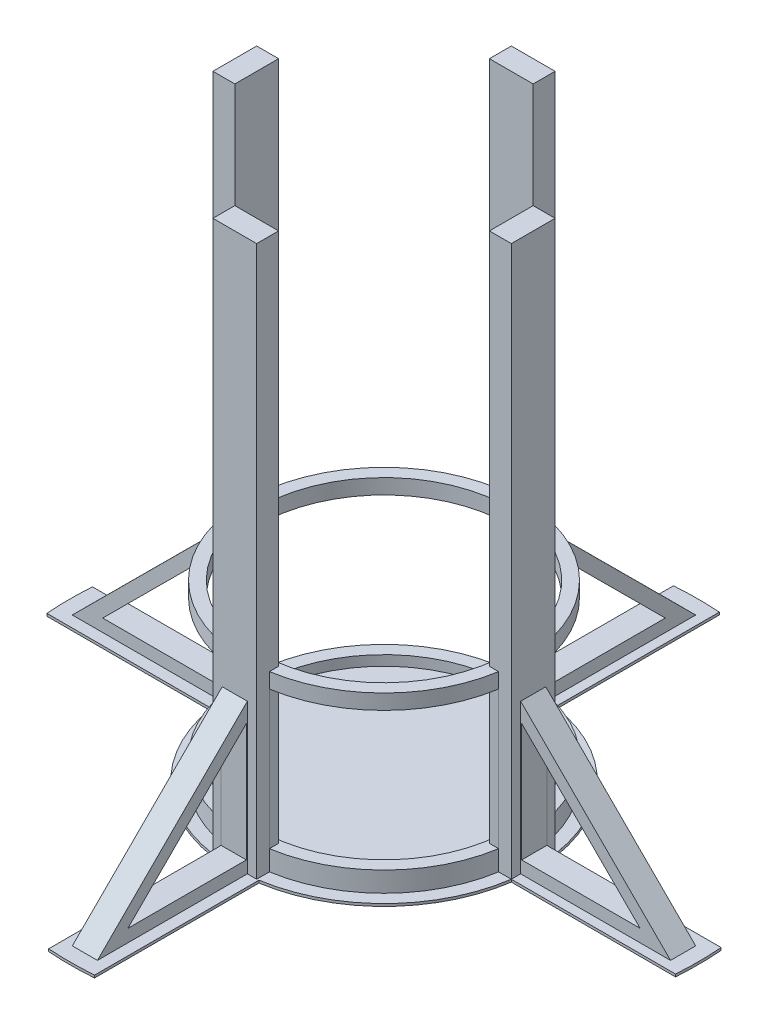
from build123d import *

# Parameters (mm, degrees)
SKETCH2_R           = 55
BOSS_EXTRUDE1_DEPTH = 70
SHELL1_T            = -5
SKETCH4_R           = 125
BOSS_EXTRUDE2_DEPTH = 1
RIB7_REACH          = 192.132
SKETCH3_WALL_W      = 472.644862012
SKETCH3_WALL_H      = 10
CIRPATTERN1_COUNT   = 4
CUT_EXTRUDE1_DEPTH  = 1
CIRPATTERN2_COUNT   = 4
CUT_EXTRUDE2_DEPTH  = 194.455421222
CIRPATTERN3_COUNT   = 4
SKETCH10_W          = 64.387061578
SKETCH10_H          = 55
CUT_EXTRUDE3_DEPTH  = 191.131533418
CIRPATTERN4_COUNT   = 2
CIRPATTERN4_ANGLE   = 90
BOSS_EXTRUDE3_START = -70
SKETCH11_W          = 8.729109108
SKETCH11_H          = 17.418342354
BOSS_EXTRUDE3_DEPTH = 220
CIRPATTERN5_COUNT   = 4


with BuildPart() as part:
    # Sketch2 → Boss-Extrude1 (new body)
    with BuildSketch(Plane(origin=(0, 0, 0), x_dir=(1, 0, 0), z_dir=(0, 1, 0))):
        with Locations(Location((0, 0, 0), (0, 0, 270))):
            Circle(SKETCH2_R)
    extrude(amount=BOSS_EXTRUDE1_DEPTH)

    # Shell1
    shell1_openings = [part.faces().sort_by_distance(p)[0] for p in [
        (0, 70, 0),
    ]]
    offset(amount=SHELL1_T, openings=shell1_openings, kind=Kind.INTERSECTION)

    # Sketch4 → Boss-Extrude2 (add)
    with BuildSketch(Plane(origin=(0, 0, 0), x_dir=(1, 0, 0), z_dir=(0, 1, 0))):
        with Locations(Location((0, 0, 0), (0, 0, 270))):
            Circle(SKETCH4_R)
    extrude(amount=BOSS_EXTRUDE2_DEPTH)

    # Sketch3 wall → Rib7 (add, up to next)
    with BuildSketch(Plane(origin=(87, 32.90951621, 0), x_dir=(0.708107200971, -0.706104943994, 0), z_dir=(0.706104943994, 0.708107200971, 0)), mode=Mode.PRIVATE) as rib7_sk1:
        Rectangle(SKETCH3_WALL_W, SKETCH3_WALL_H)
    rib7_tool1 = extrude(rib7_sk1.sketch, amount=-RIB7_REACH, mode=Mode.PRIVATE) - part.part
    rib7 = rib7_tool1.solids().sort_by_distance((87, 32.90951621, 0))[0]
    add(rib7)

    # CirPattern1: Rib7 ×4 about axis
    cirpattern1_axis = Axis((0, 0, 0), (0, 1, 0))
    for i in range(1, CIRPATTERN1_COUNT):
        add(rib7.rotate(cirpattern1_axis, i * 360 / CIRPATTERN1_COUNT))

    # Sketch5 → Cut-Extrude1 (cut)
    with BuildSketch(Plane(origin=(0, 1, 0), x_dir=(1, 0, 0), z_dir=(0, 1, 0))):
        with BuildLine():
            Line((9.493142678, -59.24424227), (9.493142678, -129.652922227))
            ThreePointArc((9.493142678, -129.652922227), (92.201319164, -91.645604065), (129.707942461, -8.709171177))
            Line((129.707942461, -8.709171177), (59.364554554, -8.709171177))
            ThreePointArc((59.364554554, -8.709171177), (42.705900876, -42.145059383), (9.493142678, -59.24424227))
        make_face()
    cut_extrude1 = extrude(amount=-CUT_EXTRUDE1_DEPTH, mode=Mode.SUBTRACT)

    # CirPattern2: Cut-Extrude1 ×4 about axis
    cirpattern2_axis = Axis((0, 0, 0), (0, 1, 0))
    for i in range(1, CIRPATTERN2_COUNT):
        add(cut_extrude1.rotate(cirpattern2_axis, i * 360 / CIRPATTERN2_COUNT), mode=Mode.SUBTRACT)

    # Sketch7 → Cut-Extrude2 (cut, through all)
    with BuildSketch(Plane(origin=(5, 0, 0), x_dir=(0, 0, -1), z_dir=(1, 0, 0))):
        Polygon((59.772255751, 52.99919304), (106.904721419, 6), (59.772255751, 6), align=None)
    cut_extrude2 = extrude(amount=-CUT_EXTRUDE2_DEPTH, mode=Mode.SUBTRACT)

    # CirPattern3: Cut-Extrude2 ×4 about axis
    cirpattern3_axis = Axis((0, 0, 0), (0, 1, 0))
    for i in range(1, CIRPATTERN3_COUNT):
        add(cut_extrude2.rotate(cirpattern3_axis, i * 360 / CIRPATTERN3_COUNT), mode=Mode.SUBTRACT)

    # Sketch10 → Cut-Extrude3 (cut, symmetric)
    with BuildSketch(Plane(origin=(0, 0, 0), x_dir=(0.7117650145966598, -3.2873850610052313e-15, 0.7024176563813135), z_dir=(-0.7024176563813135, -3.331131634682351e-15, 0.7117650145966598))):
        with Locations((-0.279356343, 36.5)):
            Rectangle(SKETCH10_W, SKETCH10_H)
    cut_extrude3 = extrude(amount=CUT_EXTRUDE3_DEPTH, both=True, mode=Mode.SUBTRACT)

    # CirPattern4: Cut-Extrude3 ×2 about axis
    cirpattern4_axis = Axis((0, 70, 0), (0, 1, 0))
    for i in range(1, CIRPATTERN4_COUNT):
        add(cut_extrude3.rotate(cirpattern4_axis, i * CIRPATTERN4_ANGLE / (CIRPATTERN4_COUNT - 1)), mode=Mode.SUBTRACT)

    # Sketch11 → Boss-Extrude3 (add)
    with BuildSketch(Plane(origin=(0, 70, 0), x_dir=(1, 0, 0), z_dir=(0, 1, 0)).offset(BOSS_EXTRUDE3_START)):
        with Locations((55, 0)):
            Rectangle(SKETCH11_W, SKETCH11_H)
    boss_extrude3 = extrude(amount=BOSS_EXTRUDE3_DEPTH)

    # CirPattern5: Boss-Extrude3 ×4 about axis
    cirpattern5_axis = Axis((0, 0, 0), (0, 1, 0))
    for i in range(1, CIRPATTERN5_COUNT):
        add(boss_extrude3.rotate(cirpattern5_axis, i * 360 / CIRPATTERN5_COUNT))


solid = part.part
